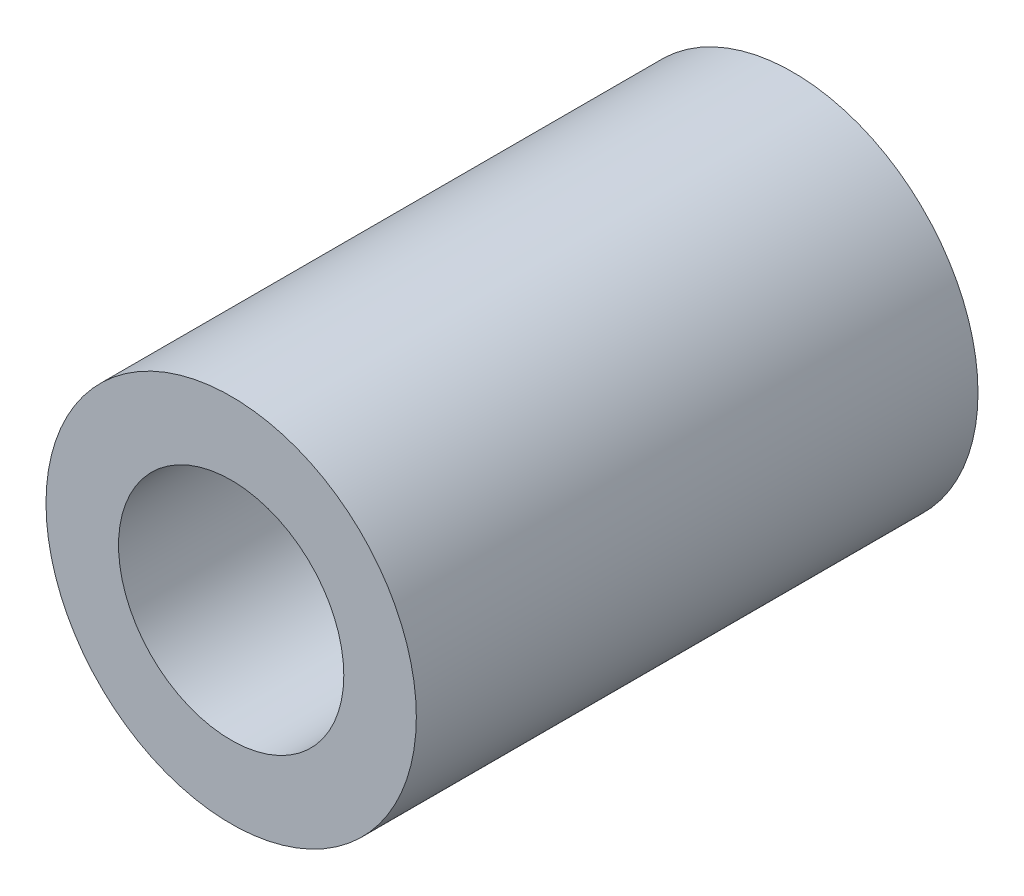
from build123d import *

# Parameters (mm, degrees)
SKETCH1_R           = 3
SKETCH1_R_2         = 1.825
BOSS_EXTRUDE1_DEPTH = 9.1


with BuildPart() as part:
    # Sketch1 → Boss-Extrude1 (new body)
    with BuildSketch(Plane.XY):
        Circle(SKETCH1_R)
        Circle(SKETCH1_R_2, mode=Mode.SUBTRACT)
    extrude(amount=BOSS_EXTRUDE1_DEPTH)


solid = part.part
